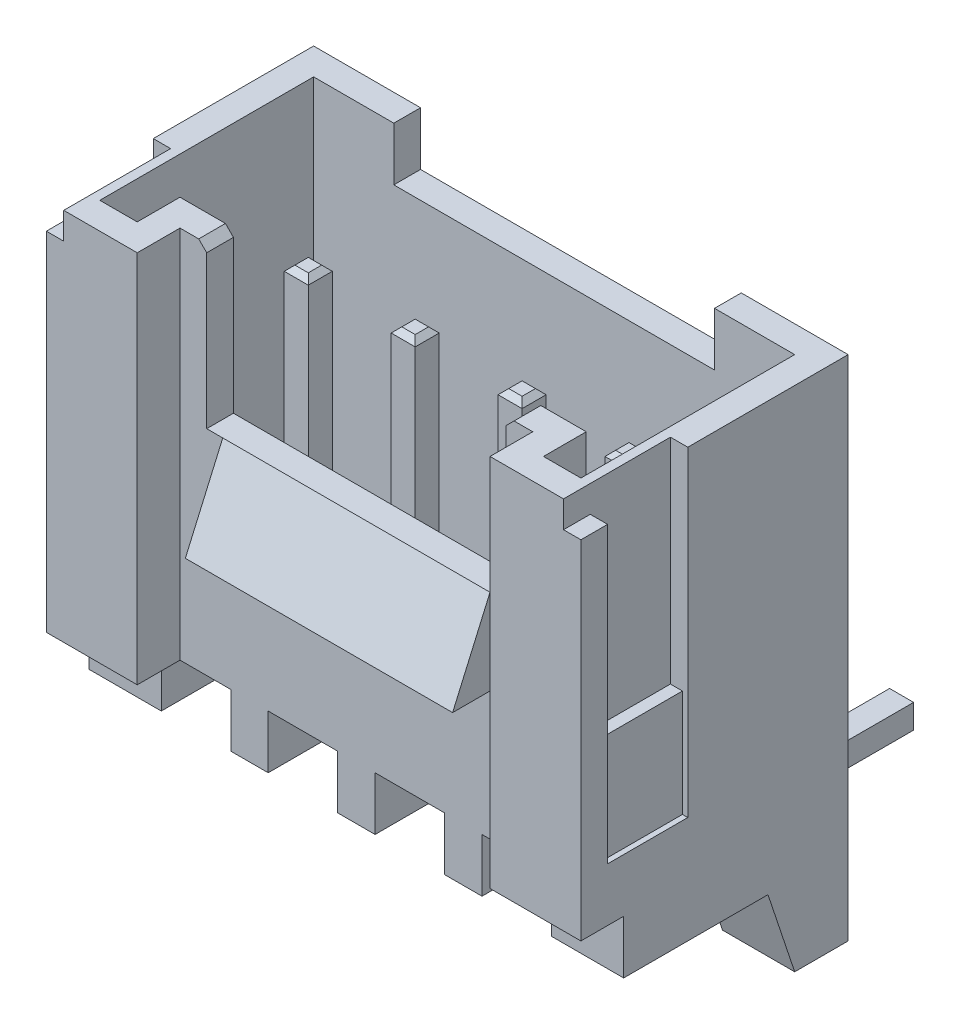
from build123d import *

# Parameters (mm, degrees)
ESQUISSE1_W                = 10
ESQUISSE1_H                = 5
BOSS_EXTRU_1_DEPTH         = 8
ESQUISSE7_W                = 0.8
ESQUISSE7_H                = 1
ENL_V_MAT_EXTRU_5_DEPTH    = 14.747727085
ENL_V_MAT_EXTRU_6_DEPTH    = 0.65
R_P_TITION_LIN_AIRE3_COUNT = 4
R_P_TITION_LIN_AIRE3_PITCH = 2
ESQUISSE2_W                = 6.6
ESQUISSE2_H                = 1.6
ENL_V_MAT_EXTRU_1_DEPTH    = 11.677078252
ENL_V_MAT_EXTRU_2_DEPTH    = 6.5
ESQUISSE5_W                = 6
ESQUISSE5_H                = 1
ENL_V_MAT_EXTRU_3_DEPTH    = 1
ESQUISSE6_W                = 5.6
ESQUISSE6_H                = 1
ENL_V_MAT_EXTRU_4_DEPTH    = 3
BOSS_EXTRU_2_DEPTH         = 2.5
CHANFREIN1_SIZE            = 0.15
EXTRU_MINCE2_DEPTH         = 0.225
R_P_TITION_LIN_AIRE4_COUNT = 4
R_P_TITION_LIN_AIRE4_PITCH = 2
BOSS_EXTRU_4_DEPTH         = 1.35
CHANFREIN2_SIZE            = 0.1
ESQUISSE19_W               = 1.5
ESQUISSE19_H               = 6.440145877
ENL_V_MAT_EXTRU_7_DEPTH    = 0.1
ENL_V_MAT_EXTRU_8_DEPTH    = 0.225
CHANFREIN3_SIZE            = 0.1
CHANFREIN4_SIZE            = 0.1
CHANFREIN5_SIZE            = 0.1


with BuildPart() as part:
    # Esquisse1 → Boss.-Extru.1 (new body)
    with BuildSketch(Plane(origin=(0, 0, 0), x_dir=(1, 0, 0), z_dir=(0, 1, 0))):
        with Locations((0, 2.5)):
            Rectangle(ESQUISSE1_W, ESQUISSE1_H)
    extrude(amount=BOSS_EXTRU_1_DEPTH)

    # Esquisse7 → Enlèv. mat.-Extru.5 (cut, through all)
    with BuildSketch(Plane(origin=(5, 0, 0), x_dir=(0, 0, -1), z_dir=(1, 0, 0))):
        with Locations((0.4, 0.5)):
            Rectangle(ESQUISSE7_W, ESQUISSE7_H)
    extrude(amount=-ENL_V_MAT_EXTRU_5_DEPTH, mode=Mode.SUBTRACT)

    # Esquisse8 → Enlèv. mat.-Extru.6 (cut, symmetric)
    with BuildSketch(Plane(origin=(3, 0, 0), x_dir=(0, 0, -1), z_dir=(1, 0, 0))):
        Polygon((0.8, 1), (1.1, 1), (1.9, 0.2), (3.9, 0.2), (4.7, 1), (5, 1), (5, 0), (0.8, 0), align=None)
    enl_v_mat_extru_6 = extrude(amount=ENL_V_MAT_EXTRU_6_DEPTH, both=True, mode=Mode.SUBTRACT)

    # Répétition linéaire3: Enlèv. mat.-Extru.6 ×4
    with Locations(*[(-i * R_P_TITION_LIN_AIRE3_PITCH, 0, 0) for i in range(1, R_P_TITION_LIN_AIRE3_COUNT)]):
        add(enl_v_mat_extru_6, mode=Mode.SUBTRACT)

    # Esquisse2 → Enlèv. mat.-Extru.1 (cut, through all)
    with BuildSketch(Plane(origin=(0, 8, 0), x_dir=(1, 0, 0), z_dir=(0, 1, 0))):
        Rectangle(ESQUISSE2_W, ESQUISSE2_H)
    extrude(amount=-ENL_V_MAT_EXTRU_1_DEPTH, mode=Mode.SUBTRACT)

    # Esquisse4 → Enlèv. mat.-Extru.2 (cut)
    with BuildSketch(Plane(origin=(0, 8, 0), x_dir=(1, 0, 0), z_dir=(0, 1, 0))):
        Polygon((-3.8, 1.3), (3.8, 1.3), (3.8, 0.5), (4.5, 0.5), (4.5, 4.5), (-4.5, 4.5), (-4.5, 0.5), (-3.8, 0.5), align=None)
    extrude(amount=-ENL_V_MAT_EXTRU_2_DEPTH, mode=Mode.SUBTRACT)

    # Esquisse5 → Enlèv. mat.-Extru.3 (cut)
    with BuildSketch(Plane(origin=(0, 8, 0), x_dir=(1, 0, 0), z_dir=(0, 1, 0))):
        with Locations((0, 4.5)):
            Rectangle(ESQUISSE5_W, ESQUISSE5_H)
    extrude(amount=-ENL_V_MAT_EXTRU_3_DEPTH, mode=Mode.SUBTRACT)

    # Esquisse6 → Enlèv. mat.-Extru.4 (cut)
    with BuildSketch(Plane(origin=(0, 8, 0), x_dir=(1, 0, 0), z_dir=(0, 1, 0))):
        with Locations((0, 0.8)):
            Rectangle(ESQUISSE6_W, ESQUISSE6_H)
    extrude(amount=-ENL_V_MAT_EXTRU_4_DEPTH, mode=Mode.SUBTRACT)

    # Esquisse11 → Boss.-Extru.2 (add, symmetric)
    with BuildSketch(Plane(origin=(0, 0, 0), x_dir=(0, 0, -1), z_dir=(1, 0, 0))):
        Polygon((0.8, 5), (0.1, 3.4), (0.8, 3.4), align=None)
    extrude(amount=BOSS_EXTRU_2_DEPTH, both=True)

    # Chanfrein1
    chanfrein1_edges = [part.edges().sort_by_distance(p)[0] for p in [
        (2.8, 8, -1.05),
        (-2.8, 8, -1.05),
    ]]
    chamfer(chanfrein1_edges, length=CHANFREIN1_SIZE)

    # Esquisse18 → Boss.-Extru.4 (add)
    with BuildSketch(Plane.ZY.offset(5)):
        Polygon((-5, 0), (-5, -1.5), (-4, -1.5), (-3.5, 0), align=None)
    boss_extru_4 = extrude(amount=-BOSS_EXTRU_4_DEPTH)

    # Esquisse19 → Enlèv. mat.-Extru.7 (cut)
    with BuildSketch(Plane.ZY.offset(5)):
        with Locations((-1.25, 5.220072939)):
            Rectangle(ESQUISSE19_W, ESQUISSE19_H)
    enl_v_mat_extru_7 = extrude(amount=-ENL_V_MAT_EXTRU_7_DEPTH, mode=Mode.SUBTRACT)

    # Esquisse20 → Enlèv. mat.-Extru.8 (cut, symmetric)
    with BuildSketch(Plane.ZY.offset(4.9)):
        Polygon((-2, 4), (-0.5, 4), (-0.5, 7.5), (0.56066855, 7.5), (0.56066855, 8.388803524), (-2, 8.388803524), align=None)
    enl_v_mat_extru_8 = extrude(amount=ENL_V_MAT_EXTRU_8_DEPTH, both=True, mode=Mode.SUBTRACT)

    # Symétrie5: Enlèv. mat.-Extru.7 across plane
    add(enl_v_mat_extru_7.mirror(Plane(origin=(0, 0, 0), x_dir=(0, 0, 1), z_dir=(1, 0, 0))), mode=Mode.SUBTRACT)

    # Symétrie6: Enlèv. mat.-Extru.8 across plane
    add(enl_v_mat_extru_8.mirror(Plane(origin=(0, 0, 0), x_dir=(0, 0, 1), z_dir=(1, 0, 0))), mode=Mode.SUBTRACT)

    # Symétrie8: Boss.-Extru.4 across plane
    add(boss_extru_4.mirror(Plane(origin=(0, 0, 0), x_dir=(0, 0, 1), z_dir=(1, 0, 0))))


with BuildPart() as body_2:
    # Esquisse16 → Extru.-Mince2 (new, symmetric)
    with BuildSketch(Plane.ZY.offset(-3)):
        with BuildLine():
            Line((-3.125, 6.5), (-3.125, -0.021727788))
            Line((-3.125, -0.021727788), (-8, -0.021727788))
            Line((-8, -0.021727788), (-8, -0.471727788))
            Line((-8, -0.471727788), (-3.05543443, -0.471727788))
            ThreePointArc((-3.05543443, -0.471727788), (-2.783090285, -0.319708306), (-2.675, -0.02713738))
            Line((-2.675, -0.02713738), (-2.675, 6.5))
            Line((-2.675, 6.5), (-3.125, 6.5))
        make_face()
    extrude(amount=EXTRU_MINCE2_DEPTH, both=True)


with BuildPart() as r_p_tition_lin_aire4_1:
    # Répétition linéaire4: pattern copy
    add(body_2.part.moved(Location(Vector(-1, 0, 0) * (1 * R_P_TITION_LIN_AIRE4_PITCH))))

    # Chanfrein5
    chanfrein5_edges = [r_p_tition_lin_aire4_1.edges().sort_by_distance(p)[0] for p in [
        (1, 6.5, -3.125),
        (1, 6.5, -2.675),
        (0.775, 6.5, -2.9),
        (1.225, 6.5, -2.9),
    ]]
    chamfer(chanfrein5_edges, length=CHANFREIN5_SIZE)


with BuildPart() as r_p_tition_lin_aire4_2:
    # Répétition linéaire4: pattern copy
    add(body_2.part.moved(Location(Vector(-1, 0, 0) * (2 * R_P_TITION_LIN_AIRE4_PITCH))))

    # Chanfrein4
    chanfrein4_edges = [r_p_tition_lin_aire4_2.edges().sort_by_distance(p)[0] for p in [
        (-1, 6.5, -3.125),
        (-1, 6.5, -2.675),
        (-1.225, 6.5, -2.9),
        (-0.775, 6.5, -2.9),
    ]]
    chamfer(chanfrein4_edges, length=CHANFREIN4_SIZE)


with BuildPart() as r_p_tition_lin_aire4_3:
    # Répétition linéaire4: pattern copy
    add(body_2.part.moved(Location(Vector(-1, 0, 0) * (3 * R_P_TITION_LIN_AIRE4_PITCH))))

    # Chanfrein3
    chanfrein3_edges = [r_p_tition_lin_aire4_3.edges().sort_by_distance(p)[0] for p in [
        (-3, 6.5, -3.125),
        (-3, 6.5, -2.675),
        (-3.225, 6.5, -2.9),
        (-2.775, 6.5, -2.9),
    ]]
    chamfer(chanfrein3_edges, length=CHANFREIN3_SIZE)


with BuildPart() as body_2_1:
    add(body_2.part)

    # Chanfrein2
    chanfrein2_edges = [body_2_1.edges().sort_by_distance(p)[0] for p in [
        (3, 6.5, -3.125),
        (3, 6.5, -2.675),
        (2.775, 6.5, -2.9),
        (3.225, 6.5, -2.9),
    ]]
    chamfer(chanfrein2_edges, length=CHANFREIN2_SIZE)


solid = Compound([part.part, r_p_tition_lin_aire4_1.part, r_p_tition_lin_aire4_2.part, r_p_tition_lin_aire4_3.part, body_2_1.part])
